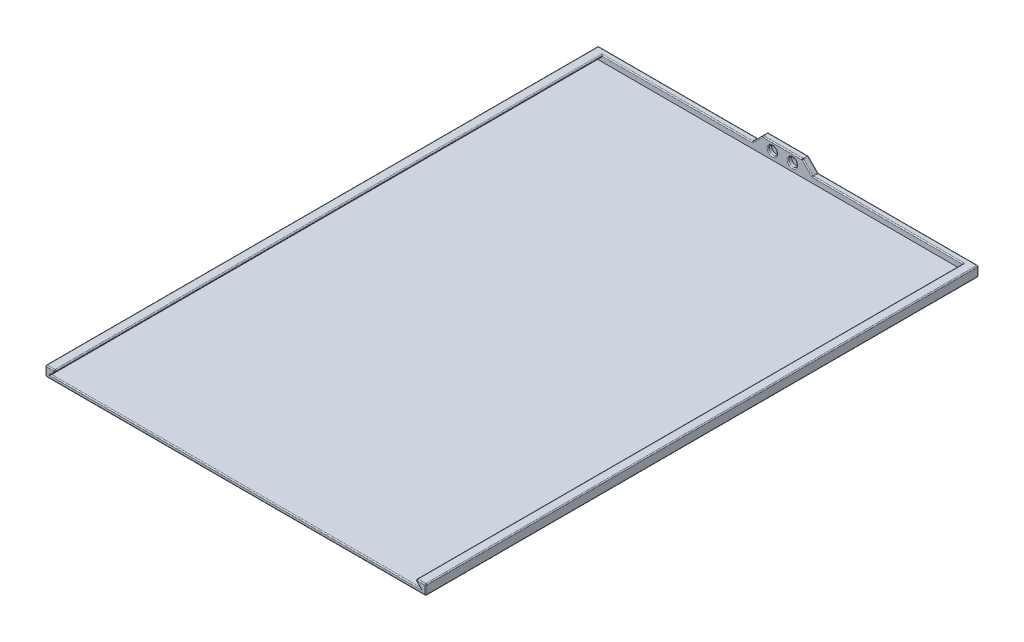
from build123d import *

# Parameters (mm, degrees)
BOSS_EXTRUDE1_DEPTH = 273.15
SKETCH1_3_R         = 2.15
BOSS_EXTRUDE2_DEPTH = 3
SKETCH1_5_R         = 2.15
CUT_EXTRUDE1_DEPTH  = 1.8
FILLET1_R           = 0.5


with BuildPart() as part:
    # Sketch1 → Boss-Extrude1 (new body)
    with BuildSketch(Plane.XY):
        Polygon((2.717157288, 0), (3, 0), (95, 0), (95, -2), (0, -2), (0, 3), (4.8, 3), (4.8, 2.082842712), (2.858578644, 0.141421356), align=None)
    extrude(amount=BOSS_EXTRUDE1_DEPTH)

    # Sketch1<3> → Boss-Extrude2 (add)
    # profile 1 of 3: a face of its own
    with BuildSketch(Plane.XY):
        Polygon((2.717157288, 0), (3, 0), (95, 0), (95, -2), (0, -2), (0, 3), (4.8, 3), (4.8, 2.082842712), (2.858578644, 0.141421356), align=None)
    # profile 2 of 3: a face of its own
    with BuildSketch(Plane.XY):
        Polygon((95, 8), (95, 3), (95, 0), (3, 0), (2.717157288, 0), (2.858578644, 0.141421356), (4.8, 2.082842712), (4.8, 3), (80, 3), (85, 8), align=None)
        with Locations((90, 4)):
            Circle(SKETCH1_3_R, mode=Mode.SUBTRACT)
    # profile 3 of 3: a face of its own
    with BuildSketch(Plane.XY):
        with Locations((90, 4)):
            Circle(SKETCH1_3_R)
    extrude(amount=-BOSS_EXTRUDE2_DEPTH)

    # Sketch1<5> → Cut-Extrude1 (cut)
    with BuildSketch(Plane.XY):
        with Locations((90, 4)):
            Circle(SKETCH1_5_R)
    extrude(amount=-CUT_EXTRUDE1_DEPTH, mode=Mode.SUBTRACT)

    # Mirror1: part across plane


with BuildPart() as part_1:
    add(part.part)
    add(part.part.mirror(Plane(origin=(95, 0, 273.15), x_dir=(0, 0, 1), z_dir=(-1, 0, 0))))

    # Fillet1
    fillet1_edges = [part_1.edges().sort_by_distance(p)[0] for p in [
        (3.758578644, 1.041421356, 273.15),
        (0, -2, 135.075),
        (0, 3, 135.075),
        (4.8, 3, 136.575),
        (4.8, 2.082842712, 136.575),
        (4.8, 2.541421356, 273.15),
        (2.4, 3, 273.15),
        (42.4, 3, 0),
        (0, 0.5, 273.15),
        (82.5, 5.5, 0),
        (80, 3, -1.5),
        (95, 8, 0),
        (85, 8, -1.5),
        (95, -2, -3),
        (0, 0.5, -3),
        (40, 3, -3),
        (82.5, 5.5, -3),
        (95, 8, -3),
        (95, -2, 273.15),
        (87.85, 4, 0),
        (185.2, 2.082842712, 136.575),
        (185.2, 3, 136.575),
        (190, 3, 135.075),
        (150, 3, -3),
        (110, 3, -1.5),
        (190, -2, 135.075),
        (190, 0.5, -3),
        (95, 0, 273.15),
        (190, 0.5, 273.15),
        (187.6, 3, 273.15),
        (185.2, 2.541421356, 273.15),
        (186.241421356, 1.041421356, 273.15),
        (107.5, 5.5, -3),
        (105, 8, -1.5),
        (102.15, 4, 0),
        (147.6, 3, 0),
        (107.5, 5.5, 0),
    ]]
    fillet(fillet1_edges, radius=FILLET1_R)


solid = part_1.part
